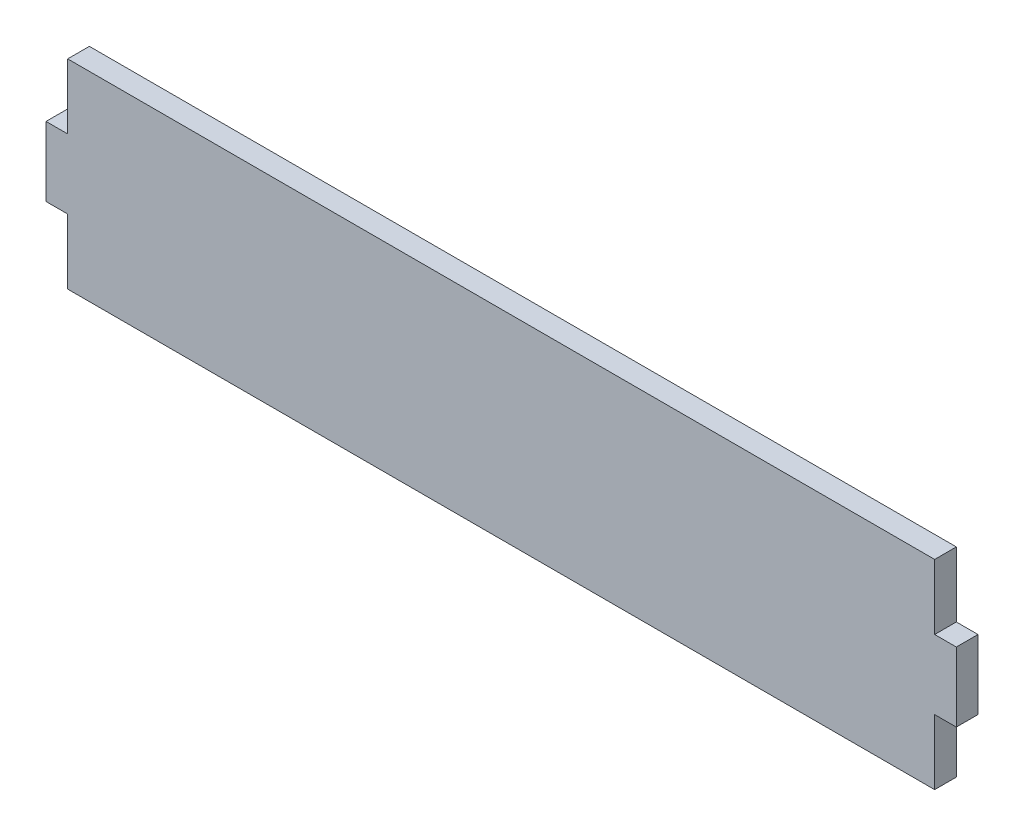
from build123d import *

# Parameters (mm, degrees)
BOSS_EXTRUDE1_DEPTH = 2.5


with BuildPart() as part:
    # Sketch1 → Boss-Extrude1 (new body)
    with BuildSketch(Plane.XY):
        Polygon((50, -4), (52.5, -4), (52.5, 4), (50, 4), (50, 11.5), (-50, 11.5), (-50, 4), (-52.5, 4), (-52.5, -4), (-50, -4), (-50, -11.5), (50, -11.5), align=None)
    extrude(amount=BOSS_EXTRUDE1_DEPTH)


solid = part.part
